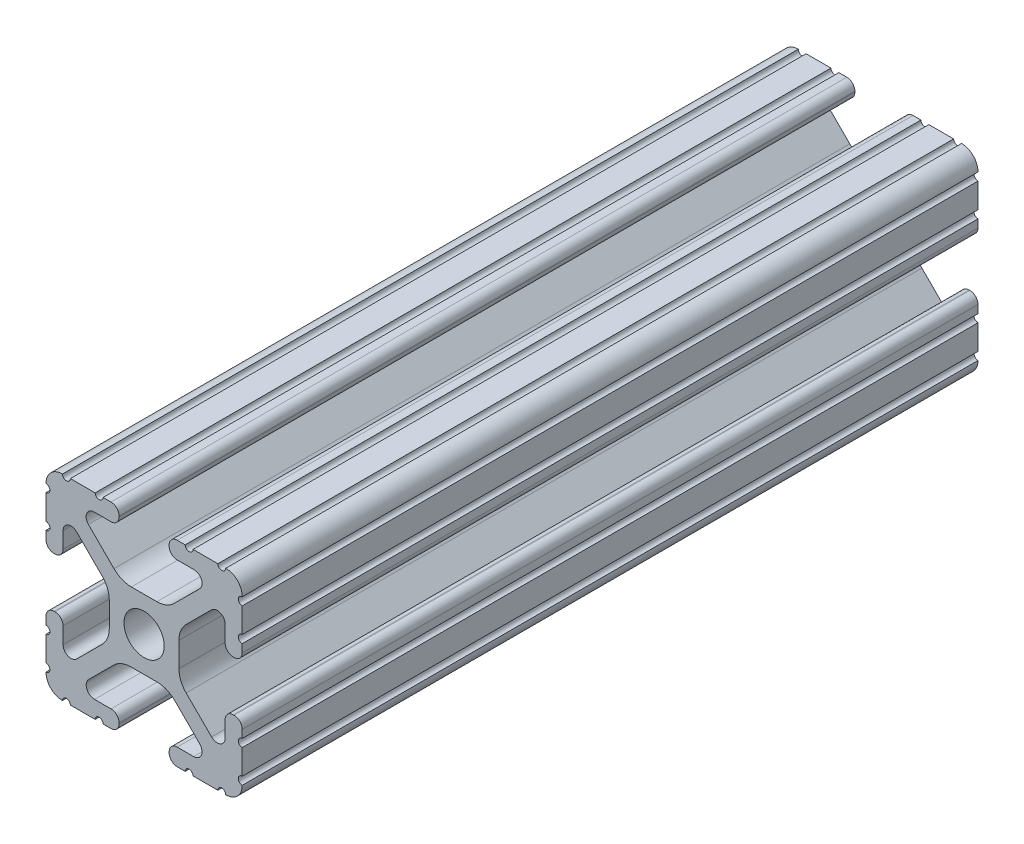
from build123d import *

# Parameters (mm, degrees)
SKETCH1_R           = 2.6035
BOSS_EXTRUDE1_DEPTH = 47.625


with BuildPart() as part:
    # Sketch1 → Boss-Extrude1 (new, symmetric)
    with BuildSketch(Plane.XY):
        with BuildLine():
            Line((-7.179650497, -8.645192506), (-3.952270251, -5.423690499))
            ThreePointArc((-3.952270251, -5.423690499), (-2.922936451, -4.736929036), (-1.709253557, -4.4958))
            Line((-1.709253557, -4.4958), (1.709253557, -4.4958))
            ThreePointArc((1.709253557, -4.4958), (2.922936451, -4.736929036), (3.952270251, -5.423690499))
            Line((3.952270251, -5.423690499), (7.179650497, -8.645192506))
            ThreePointArc((7.179650497, -8.645192506), (7.41473083, -9.822813117), (6.416408329, -10.4902))
            Line((6.416408329, -10.4902), (4.287512407, -10.4902))
            ThreePointArc((4.287512407, -10.4902), (3.54574862, -10.79744862), (3.2385, -11.539212407))
            Line((3.2385, -11.539212407), (3.2385, -11.650987593))
            ThreePointArc((3.2385, -11.650987593), (3.54574862, -12.39275138), (4.287512407, -12.7))
            Line((4.287512407, -12.7), (5.317126718, -12.7))
            ThreePointArc((5.317126718, -12.7), (5.825126718, -12.192), (6.333126718, -12.7))
            Line((6.333126718, -12.7), (9.550443118, -12.7))
            ThreePointArc((9.550443118, -12.7), (10.058366869, -12.192000006), (10.566443095, -12.699847501))
            ThreePointArc((10.566443095, -12.699847501), (12.082537762, -12.08250727), (12.699846982, -10.566399977))
            ThreePointArc((12.699846982, -10.566399977), (12.192000006, -10.058323491), (12.7, -9.5504))
            Line((12.7, -9.5504), (12.7, -6.3330836))
            ThreePointArc((12.7, -6.3330836), (12.192, -5.8250836), (12.7, -5.3170836))
            Line((12.7, -5.3170836), (12.7, -4.287469289))
            ThreePointArc((12.7, -4.287469289), (12.39275138, -3.545705502), (11.650987593, -3.238456882))
            Line((11.650987593, -3.238456882), (11.539212407, -3.238456882))
            ThreePointArc((11.539212407, -3.238456882), (10.79744862, -3.545705502), (10.4902, -4.287469289))
            Line((10.4902, -4.287469289), (10.4902, -6.402089023))
            ThreePointArc((10.4902, -6.402089023), (9.856505071, -7.351067942), (8.737131347, -7.129408934))
            Line((8.737131347, -7.129408934), (5.441005833, -3.840816462))
            ThreePointArc((5.441005833, -3.840816462), (4.750877967, -2.809883091), (4.5085, -1.593185507))
            Line((4.5085, -1.593185507), (4.5085, 1.593185507))
            ThreePointArc((4.5085, 1.593185507), (4.750877967, 2.809883091), (5.441005833, 3.840816462))
            Line((5.441005833, 3.840816462), (8.737131347, 7.129408934))
            ThreePointArc((8.737131347, 7.129408934), (9.856505071, 7.351067942), (10.4902, 6.402089023))
            Line((10.4902, 6.402089023), (10.4902, 4.287469289))
            ThreePointArc((10.4902, 4.287469289), (10.79744862, 3.545705502), (11.539212407, 3.238456882))
            Line((11.539212407, 3.238456882), (11.650987593, 3.238456882))
            ThreePointArc((11.650987593, 3.238456882), (12.39275138, 3.545705502), (12.7, 4.287469289))
            Line((12.7, 4.287469289), (12.7, 5.3170836))
            ThreePointArc((12.7, 5.3170836), (12.192, 5.8250836), (12.7, 6.3330836))
            Line((12.7, 6.3330836), (12.7, 9.5504))
            ThreePointArc((12.7, 9.5504), (12.192000006, 10.058323491), (12.699846982, 10.566399977))
            ThreePointArc((12.699846982, 10.566399977), (12.082537762, 12.08250727), (10.566443095, 12.699847501))
            ThreePointArc((10.566443095, 12.699847501), (10.058366869, 12.192000006), (9.550443118, 12.7))
            Line((9.550443118, 12.7), (6.333126718, 12.7))
            ThreePointArc((6.333126718, 12.7), (5.825126718, 12.192), (5.317126718, 12.7))
            Line((5.317126718, 12.7), (4.287512407, 12.7))
            ThreePointArc((4.287512407, 12.7), (3.54574862, 12.39275138), (3.2385, 11.650987593))
            Line((3.2385, 11.650987593), (3.2385, 11.539212407))
            ThreePointArc((3.2385, 11.539212407), (3.54574862, 10.79744862), (4.287512407, 10.4902))
            Line((4.287512407, 10.4902), (6.476788598, 10.4902))
            ThreePointArc((6.476788598, 10.4902), (7.432222385, 9.85140422), (7.207036008, 8.724370562))
            Line((7.207036008, 8.724370562), (3.898272566, 5.423169045))
            ThreePointArc((3.898272566, 5.423169045), (2.869120213, 4.736787962), (1.655778399, 4.4958))
            Line((1.655778399, 4.4958), (-1.655778399, 4.4958))
            ThreePointArc((-1.655778399, 4.4958), (-2.869120213, 4.736787962), (-3.898272566, 5.423169045))
            Line((-3.898272566, 5.423169045), (-7.207036008, 8.724370562))
            ThreePointArc((-7.207036008, 8.724370562), (-7.432222385, 9.85140422), (-6.476788598, 10.4902))
            Line((-6.476788598, 10.4902), (-4.287512407, 10.4902))
            ThreePointArc((-4.287512407, 10.4902), (-3.54574862, 10.79744862), (-3.2385, 11.539212407))
            Line((-3.2385, 11.539212407), (-3.2385, 11.650987593))
            ThreePointArc((-3.2385, 11.650987593), (-3.54574862, 12.39275138), (-4.287512407, 12.7))
            Line((-4.287512407, 12.7), (-5.317126718, 12.7))
            ThreePointArc((-5.317126718, 12.7), (-5.825126718, 12.192), (-6.333126718, 12.7))
            Line((-6.333126718, 12.7), (-9.550443118, 12.7))
            ThreePointArc((-9.550443118, 12.7), (-10.058366869, 12.192000006), (-10.566443095, 12.699847501))
            ThreePointArc((-10.566443095, 12.699847501), (-12.082537762, 12.08250727), (-12.699846982, 10.566399977))
            ThreePointArc((-12.699846982, 10.566399977), (-12.192000006, 10.058323491), (-12.7, 9.5504))
            Line((-12.7, 9.5504), (-12.7, 6.3330836))
            ThreePointArc((-12.7, 6.3330836), (-12.192, 5.8250836), (-12.7, 5.3170836))
            Line((-12.7, 5.3170836), (-12.7, 4.287469289))
            ThreePointArc((-12.7, 4.287469289), (-12.39275138, 3.545705502), (-11.650987593, 3.238456882))
            Line((-11.650987593, 3.238456882), (-11.539212407, 3.238456882))
            ThreePointArc((-11.539212407, 3.238456882), (-10.79744862, 3.545705502), (-10.4902, 4.287469289))
            Line((-10.4902, 4.287469289), (-10.4902, 6.402089023))
            ThreePointArc((-10.4902, 6.402089023), (-9.856505071, 7.351067942), (-8.737131347, 7.129408934))
            Line((-8.737131347, 7.129408934), (-5.441005833, 3.840816462))
            ThreePointArc((-5.441005833, 3.840816462), (-4.750877967, 2.809883091), (-4.5085, 1.593185507))
            Line((-4.5085, 1.593185507), (-4.5085, -1.593185507))
            ThreePointArc((-4.5085, -1.593185507), (-4.750877967, -2.809883091), (-5.441005833, -3.840816462))
            Line((-5.441005833, -3.840816462), (-8.737131347, -7.129408934))
            ThreePointArc((-8.737131347, -7.129408934), (-9.856505071, -7.351067942), (-10.4902, -6.402089023))
            Line((-10.4902, -6.402089023), (-10.4902, -4.287469289))
            ThreePointArc((-10.4902, -4.287469289), (-10.79744862, -3.545705502), (-11.539212407, -3.238456882))
            Line((-11.539212407, -3.238456882), (-11.650987593, -3.238456882))
            ThreePointArc((-11.650987593, -3.238456882), (-12.39275138, -3.545705502), (-12.7, -4.287469289))
            Line((-12.7, -4.287469289), (-12.7, -5.3170836))
            ThreePointArc((-12.7, -5.3170836), (-12.192, -5.8250836), (-12.7, -6.3330836))
            Line((-12.7, -6.3330836), (-12.7, -9.5504))
            ThreePointArc((-12.7, -9.5504), (-12.192000006, -10.058323491), (-12.699846982, -10.566399977))
            ThreePointArc((-12.699846982, -10.566399977), (-12.082537762, -12.08250727), (-10.566443095, -12.699847501))
            ThreePointArc((-10.566443095, -12.699847501), (-10.058366869, -12.192000006), (-9.550443118, -12.7))
            Line((-9.550443118, -12.7), (-6.333126718, -12.7))
            ThreePointArc((-6.333126718, -12.7), (-5.825126718, -12.192), (-5.317126718, -12.7))
            Line((-5.317126718, -12.7), (-4.287512407, -12.7))
            ThreePointArc((-4.287512407, -12.7), (-3.54574862, -12.39275138), (-3.2385, -11.650987593))
            Line((-3.2385, -11.650987593), (-3.2385, -11.539212407))
            ThreePointArc((-3.2385, -11.539212407), (-3.54574862, -10.79744862), (-4.287512407, -10.4902))
            Line((-4.287512407, -10.4902), (-6.416408329, -10.4902))
            ThreePointArc((-6.416408329, -10.4902), (-7.41473083, -9.822813117), (-7.179650497, -8.645192506))
        make_face()
        Circle(SKETCH1_R, mode=Mode.SUBTRACT)
    extrude(amount=BOSS_EXTRUDE1_DEPTH, both=True)


solid = part.part
